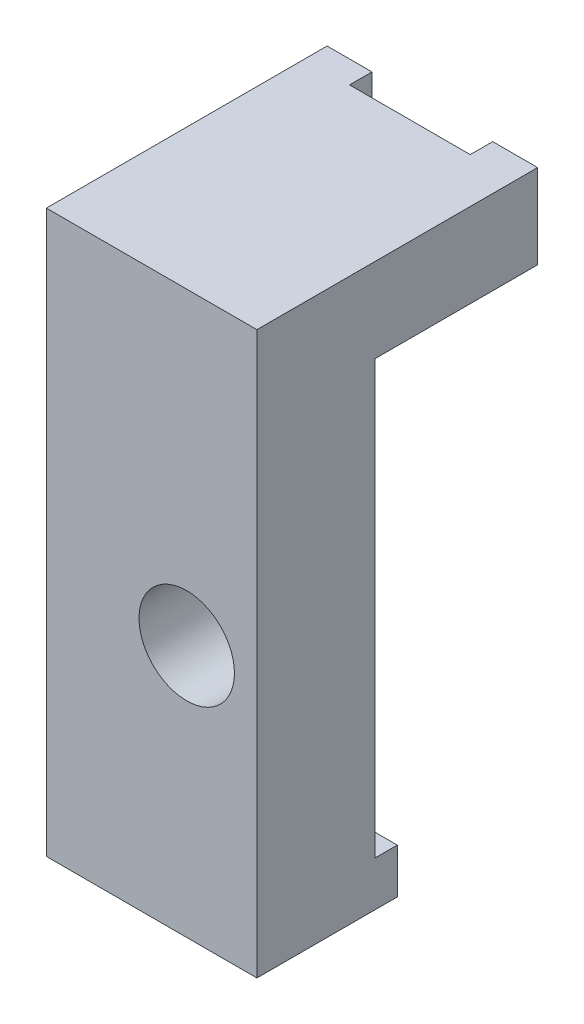
from build123d import *

# Parameters (mm, degrees)
SKETCH1_W           = 9.525
SKETCH1_H           = 25.4
BOSS_EXTRUDE1_DEPTH = 6.35
CUT_EXTRUDE1_REACH  = 19.098
SKETCH2_W           = 6.35
SKETCH2_H           = 21.59
CUT_EXTRUDE2_REACH  = 20.581
SKETCH3_R           = 2.159
CUT_EXTRUDE3_REACH  = 28.611
SKETCH4_W           = 5.461
SKETCH4_H           = 1.016
SKETCH5_W           = 1.016
SKETCH5_H           = 19.558
CUT_EXTRUDE4_DEPTH  = 18.097898263


with BuildPart() as part:
    # Sketch1 → Boss-Extrude1 (new, symmetric)
    with BuildSketch(Plane.XY):
        Rectangle(SKETCH1_W, SKETCH1_H)
    extrude(amount=BOSS_EXTRUDE1_DEPTH, both=True)

    # Sketch2 → Cut-Extrude1 (cut, up to next)
    with BuildSketch(Plane(origin=(4.7625, 0, 0), x_dir=(0, 0, -1), z_dir=(1, 0, 0)), mode=Mode.PRIVATE) as cut_extrude1_sk1:
        with Locations((3.175, -1.905)):
            Rectangle(SKETCH2_W, SKETCH2_H)
    cut_extrude1_tool1 = extrude(cut_extrude1_sk1.sketch, amount=-CUT_EXTRUDE1_REACH, mode=Mode.PRIVATE) & part.part
    add(cut_extrude1_tool1.solids().sort_by_distance((4.7625, -1.905, -3.175))[0], mode=Mode.SUBTRACT)

    # Sketch3 → Cut-Extrude2 (cut, up to next)
    with BuildSketch(Plane.XY.offset(6.35), mode=Mode.PRIVATE) as cut_extrude2_sk1:
        with Locations((1.5875, -1.27)):
            Circle(SKETCH3_R)
    cut_extrude2_tool1 = extrude(cut_extrude2_sk1.sketch, amount=-CUT_EXTRUDE2_REACH, mode=Mode.PRIVATE) & part.part
    add(cut_extrude2_tool1.solids().sort_by_distance((1.5875, -1.27, 6.35))[0], mode=Mode.SUBTRACT)

    # Sketch4 → Cut-Extrude3 (cut, up to next)
    with BuildSketch(Plane(origin=(0, 12.7, 0), x_dir=(1, 0, 0), z_dir=(0, 1, 0)), mode=Mode.PRIVATE) as cut_extrude3_sk1:
        with Locations((0, 5.842)):
            Rectangle(SKETCH4_W, SKETCH4_H)
    cut_extrude3_tool1 = extrude(cut_extrude3_sk1.sketch, amount=-CUT_EXTRUDE3_REACH, mode=Mode.PRIVATE) & part.part
    add(cut_extrude3_tool1.solids().sort_by_distance((0, 12.7, -5.842))[0], mode=Mode.SUBTRACT)

    # Sketch5 → Cut-Extrude4 (cut, through all)
    with BuildSketch(Plane(origin=(4.7625, 0, 0), x_dir=(0, 0, -1), z_dir=(1, 0, 0))):
        with Locations((-0.508, -0.889)):
            Rectangle(SKETCH5_W, SKETCH5_H)
    extrude(amount=-CUT_EXTRUDE4_DEPTH, mode=Mode.SUBTRACT)


solid = part.part
